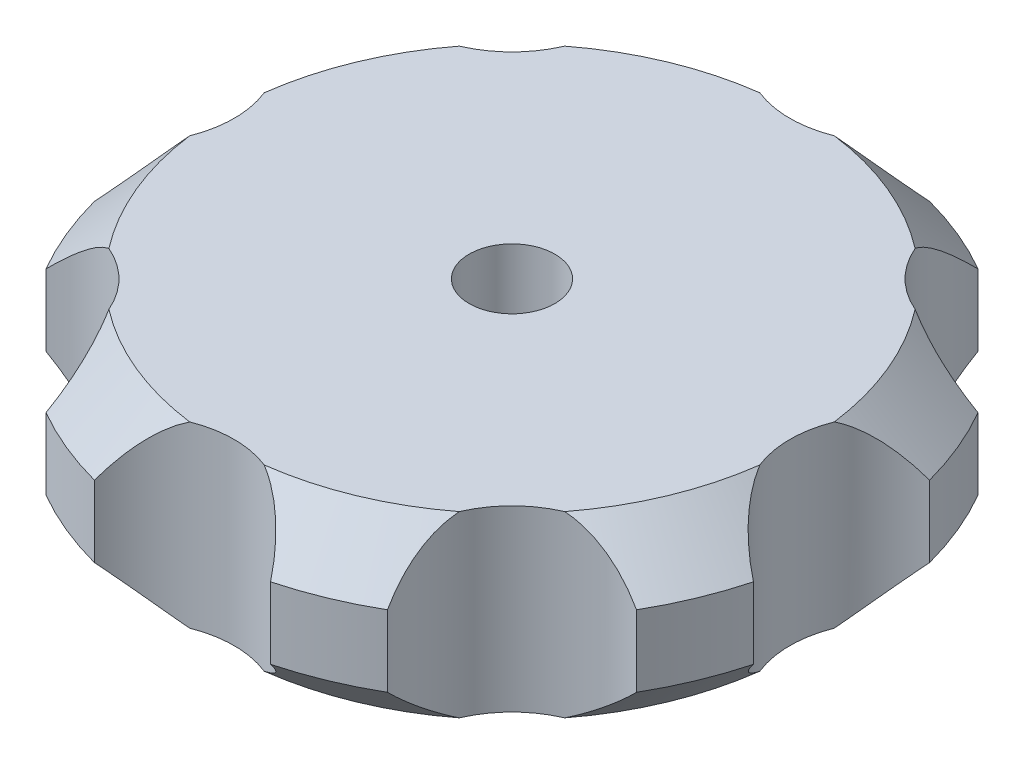
from build123d import *

# Parameters (mm, degrees)
BOSS_EXTRUDE1_DEPTH  = 10
CHAMFER1_SIZE        = 3
M4_CLEARANCE_HOLE1_D = 4.8


with BuildPart() as part:
    # Sketch1 → Boss-Extrude1 (new body)
    with BuildSketch(Plane(origin=(0, 0, 0), x_dir=(1, 0, 0), z_dir=(0, 1, 0))):
        with BuildLine():
            ThreePointArc((4.929173178, -18.444040543), (0, -15.55551692), (-4.929173178, -18.444040543))
            ThreePointArc((-4.929173178, -18.444040543), (-7.30594069, -17.6381011), (-9.556454361, -16.527357921))
            ThreePointArc((-9.556454361, -16.527357921), (-10.999411499, -10.999411499), (-16.527357921, -9.556454361))
            ThreePointArc((-16.527357921, -9.556454361), (-17.6381011, -7.30594069), (-18.444040543, -4.929173178))
            ThreePointArc((-18.444040543, -4.929173178), (-15.55551692, 0), (-18.444040543, 4.929173178))
            ThreePointArc((-18.444040543, 4.929173178), (-17.6381011, 7.30594069), (-16.527357921, 9.556454361))
            ThreePointArc((-16.527357921, 9.556454361), (-10.999411499, 10.999411499), (-9.556454361, 16.527357921))
            ThreePointArc((-9.556454361, 16.527357921), (-7.30594069, 17.6381011), (-4.929173178, 18.444040543))
            ThreePointArc((-4.929173178, 18.444040543), (0, 15.55551692), (4.929173178, 18.444040543))
            ThreePointArc((4.929173178, 18.444040543), (7.30594069, 17.6381011), (9.556454361, 16.527357921))
            ThreePointArc((9.556454361, 16.527357921), (10.999411499, 10.999411499), (16.527357921, 9.556454361))
            ThreePointArc((16.527357921, 9.556454361), (17.6381011, 7.30594069), (18.444040543, 4.929173178))
            ThreePointArc((18.444040543, 4.929173178), (15.55551692, 0), (18.444040543, -4.929173178))
            ThreePointArc((18.444040543, -4.929173178), (17.6381011, -7.30594069), (16.527357921, -9.556454361))
            ThreePointArc((16.527357921, -9.556454361), (10.999411499, -10.999411499), (9.556454361, -16.527357921))
            ThreePointArc((9.556454361, -16.527357921), (7.30594069, -17.6381011), (4.929173178, -18.444040543))
        make_face()
    extrude(amount=BOSS_EXTRUDE1_DEPTH)

    # Chamfer1
    chamfer1_edges = [part.edges().sort_by_distance(p)[0] for p in [
        (7.30594069, 10, -17.6381011),
        (17.6381011, 0, 7.30594069),
        (7.30594069, 0, 17.6381011),
        (-7.30594069, 0, 17.6381011),
        (-17.6381011, 0, 7.30594069),
        (-17.6381011, 0, -7.30594069),
        (-7.30594069, 0, -17.6381011),
        (-7.30594069, 10, -17.6381011),
        (7.30594069, 0, -17.6381011),
        (17.6381011, 0, -7.30594069),
        (-17.6381011, 10, -7.30594069),
        (-17.6381011, 10, 7.30594069),
        (-7.30594069, 10, 17.6381011),
        (17.6381011, 10, -7.30594069),
        (7.30594069, 10, 17.6381011),
        (17.6381011, 10, 7.30594069),
    ]]
    chamfer(chamfer1_edges, length=CHAMFER1_SIZE)

    # M4 Clearance Hole1 (through all)
    with Locations(Plane(origin=(0, 10, 0), x_dir=(1, 0, 0), z_dir=(0, 1, 0))):
        with Locations((0, 0)):
            Hole(M4_CLEARANCE_HOLE1_D / 2)


solid = part.part
